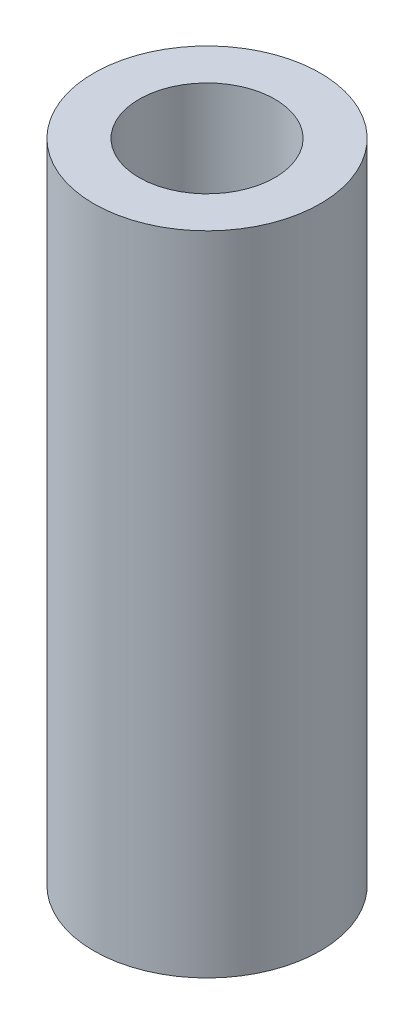
from build123d import *

# Parameters (mm, degrees)
SKETCH_1_R      = 3.5
SKETCH_1_R_2    = 2.1
EXTRUDE_1_DEPTH = 20


with BuildPart() as part:
    # 草图1 → 凸台-拉伸1 (new body)
    with BuildSketch(Plane(origin=(0, 0, 0), x_dir=(1, 0, 0), z_dir=(0, 1, 0))):
        with Locations(Location((0, 0, 0), (0, 0, 270))):
            Circle(SKETCH_1_R)
        with Locations(Location((0, 0, 0), (0, 0, 270))):
            Circle(SKETCH_1_R_2, mode=Mode.SUBTRACT)
    extrude(amount=EXTRUDE_1_DEPTH)


solid = part.part
